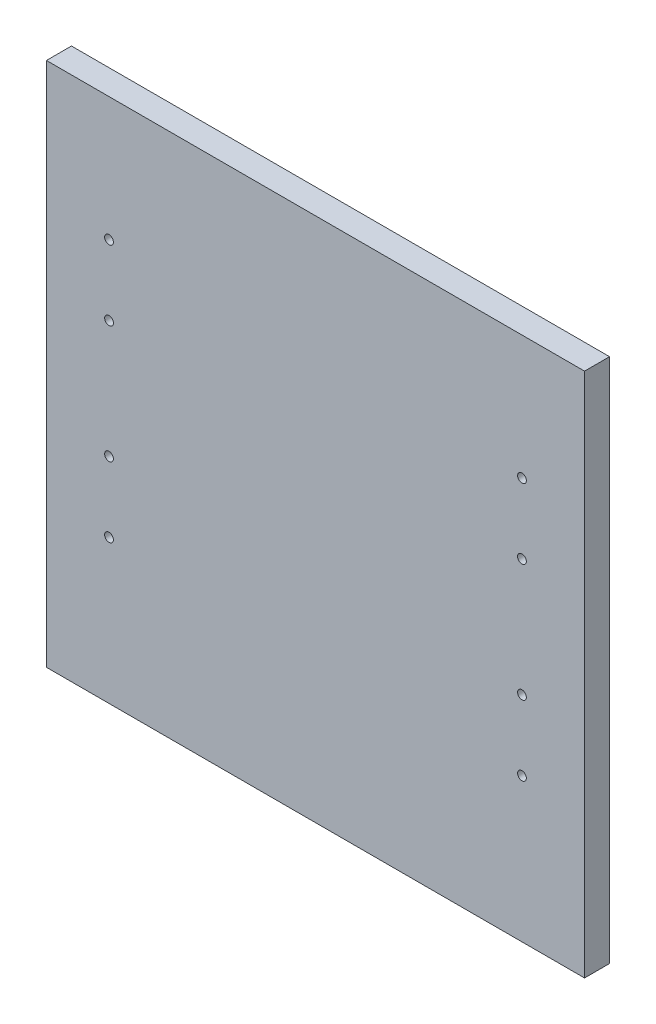
from build123d import *

# Parameters (mm, degrees)
SKETCH_1_W      = 430
SKETCH_1_H      = 420
SKETCH_1_R      = 3.5
EXTRUDE_1_DEPTH = 20


with BuildPart() as part:
    # Эскиз1 → Бобышка-Вытянуть1 (new body)
    with BuildSketch(Plane.XY):
        Rectangle(SKETCH_1_W, SKETCH_1_H)
        with Locations((-165, -95)):
            Circle(SKETCH_1_R, mode=Mode.SUBTRACT)
        with Locations((-165, -39)):
            Circle(SKETCH_1_R, mode=Mode.SUBTRACT)
        with Locations((165, -95)):
            Circle(SKETCH_1_R, mode=Mode.SUBTRACT)
        with Locations((165, -39)):
            Circle(SKETCH_1_R, mode=Mode.SUBTRACT)
        with Locations((-165, 55)):
            Circle(SKETCH_1_R, mode=Mode.SUBTRACT)
        with Locations((-165, 111)):
            Circle(SKETCH_1_R, mode=Mode.SUBTRACT)
        with Locations((165, 55)):
            Circle(SKETCH_1_R, mode=Mode.SUBTRACT)
        with Locations((165, 111)):
            Circle(SKETCH_1_R, mode=Mode.SUBTRACT)
    extrude(amount=EXTRUDE_1_DEPTH)


solid = part.part
